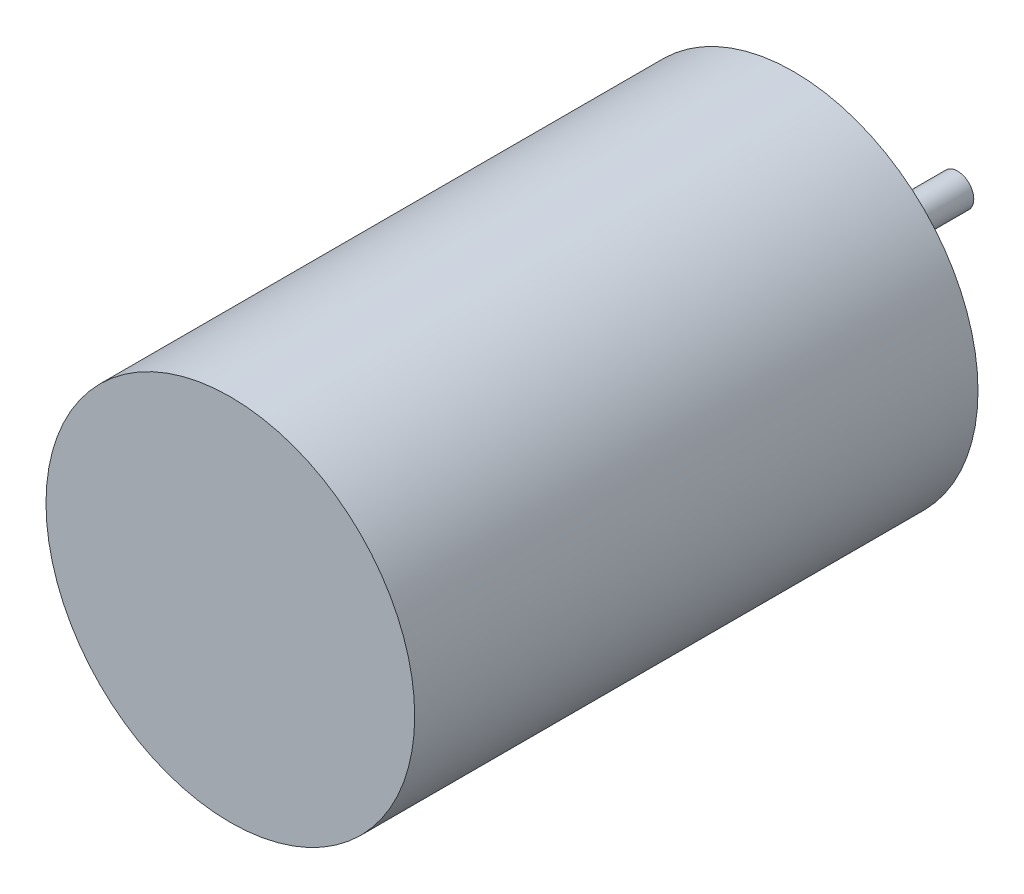
from build123d import *

# Parameters (mm, degrees)
SKETCH3_R           = 18
BOSS_EXTRUDE1_DEPTH = 55
SKETCH4_R           = 1.5875
BOSS_EXTRUDE2_DEPTH = 16


with BuildPart() as part:
    # Sketch3 → Boss-Extrude1 (new body)
    with BuildSketch(Plane.XY):
        Circle(SKETCH3_R)
    extrude(amount=BOSS_EXTRUDE1_DEPTH)

    # Sketch4 → Boss-Extrude2 (add)
    with BuildSketch(Plane(origin=(0, 0, 0), x_dir=(-1, 0, 0), z_dir=(0, 0, -1))):
        with Locations(Location((0, 0, 0), (0, 0, 180))):
            Circle(SKETCH4_R)
    extrude(amount=BOSS_EXTRUDE2_DEPTH)


solid = part.part
